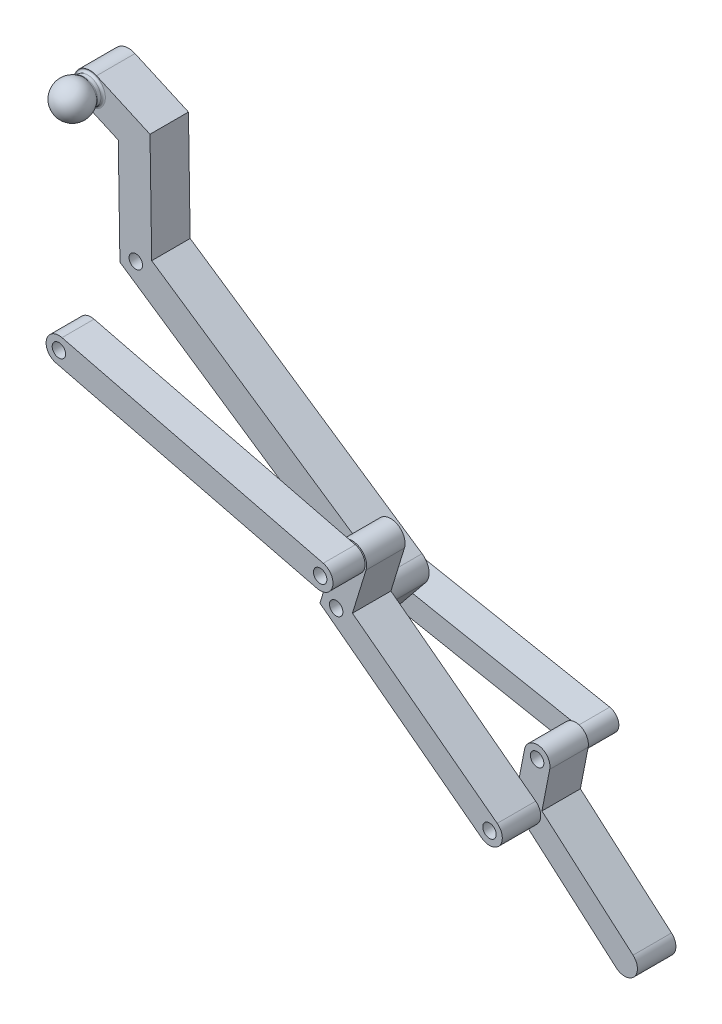
from build123d import *

# Parameters (mm, degrees)
BOSS_EXTRU_1_DEPTH           = 6
BOSS_EXTRU_2_DEPTH           = 6
BOSS_EXTRU_3_DEPTH           = 6
BOSS_EXTRU_4_START           = 6
BOSS_EXTRU_4_DEPTH           = 5
BOSS_EXTRU_5_START           = -6
BOSS_EXTRU_5_DEPTH           = 5
ENL_V_MAT_EXTRU_1_DEPTH      = 114.377471944
ENL_V_MAT_EXTRU_1_DEPTH_BACK = 114.377471944
ESQUISSE13_R                 = 1.05
ESQUISSE18_R                 = 2.05
BOSS_EXTRU_7_DEPTH           = 2
CONG_1_R                     = 0.35


with BuildPart() as part:
    # Esquisse6 → Boss.-Extru.1 (new body)
    with BuildSketch(Plane.XY):
        with BuildLine():
            Line((17.520833455, 1.659320664), (53.603544682, -22.767243471))
            Line((53.603544682, -22.767243471), (51.224988394, -25.694427738))
            ThreePointArc((51.224988394, -25.694427738), (51.588633301, -29.211210697), (55.10541626, -28.84756579))
            Line((55.10541626, -28.84756579), (59.204495728, -23.803009565))
            ThreePointArc((59.204495728, -23.803009565), (59.737439942, -21.861079373), (58.665750714, -20.156202661))
            Line((58.665750714, -20.156202661), (22.479166545, 4.340679336))
            Line((22.479166545, 4.340679336), (22.21173251, 21.297605282))
            Line((22.21173251, 21.297605282), (13.87148757, 25.027755547))
            ThreePointArc((13.87148757, 25.027755547), (10.568654312, 23.766291133), (11.830118726, 20.463457875))
            Line((11.830118726, 20.463457875), (17.262585357, 18.033802992))
            Line((17.262585357, 18.033802992), (17.520833455, 1.659320664))
        make_face()
    extrude(amount=-BOSS_EXTRU_1_DEPTH)


with BuildPart() as body_2:
    # Esquisse7 → Boss.-Extru.2 (new body)
    with BuildSketch(Plane.XY):
        with BuildLine():
            Line((54.728499187, -22.815417525), (57.616448353, -13.440743144))
            ThreePointArc((57.616448353, -13.440743144), (60.429142263, -11.952874545), (61.917010862, -14.765568456))
            Line((61.917010862, -14.765568456), (59.800064405, -21.637463553))
            Line((59.800064405, -21.637463553), (82.391906796, -38.737117746))
            ThreePointArc((82.391906796, -38.737117746), (82.779587834, -41.538849963), (79.977855618, -41.926531001))
            Line((79.977855618, -41.926531001), (54.728499187, -22.815417525))
        make_face()
    extrude(amount=BOSS_EXTRU_2_DEPTH)


with BuildPart() as body_3:
    # Esquisse8 → Boss.-Extru.3 (new body)
    with BuildSketch(Plane.XY):
        with BuildLine():
            Line((79.001000292, -41.082822034), (94.96112625, -54.967912393))
            ThreePointArc((94.96112625, -54.967912393), (97.78274183, -54.771735133), (97.58656457, -51.950119552))
            Line((97.58656457, -51.950119552), (83.368762121, -39.580826714))
            Line((83.368762121, -39.580826714), (84.581983157, -33.352591011))
            ThreePointArc((84.581983157, -33.352591011), (83.001280876, -31.007088869), (80.655778734, -32.58779115))
            Line((80.655778734, -32.58779115), (79.001000292, -41.082822034))
        make_face()
    extrude(amount=-BOSS_EXTRU_3_DEPTH)


with BuildPart() as body_4:
    # Esquisse9 → Boss.-Extru.4 (new body)
    with BuildSketch(Plane.XY.offset(BOSS_EXTRU_4_START)):
        with BuildLine():
            Line((19.481102657, -2.058727162), (60.247832265, -12.161882961))
            ThreePointArc((60.247832265, -12.161882961), (61.708002446, -14.584258457), (59.28562695, -16.044428638))
            Line((59.28562695, -16.044428638), (18.518897343, -5.941272838))
            ThreePointArc((18.518897343, -5.941272838), (17.058727162, -3.518897343), (19.481102657, -2.058727162))
        make_face()
    extrude(amount=BOSS_EXTRU_4_DEPTH)


with BuildPart() as body_5:
    # Esquisse10 → Boss.-Extru.5 (new body)
    with BuildSketch(Plane.XY.offset(BOSS_EXTRU_5_START)):
        with BuildLine():
            Line((53.497655329, -25.552865511), (82.951333947, -31.252059828))
            ThreePointArc((82.951333947, -31.252059828), (84.337012198, -33.302644082), (82.286427944, -34.688322333))
            Line((82.286427944, -34.688322333), (52.832749325, -28.989128017))
            ThreePointArc((52.832749325, -28.989128017), (51.447071074, -26.938543762), (53.497655329, -25.552865511))
        make_face()
    extrude(amount=-BOSS_EXTRU_5_DEPTH)


with BuildPart() as enl_v_mat_extru_1_tool:
    # Esquisse13 → Enlèv. mat.-Extru.1 (new, two sides: drawn at the far end of the back side and taken through both)
    with BuildSketch(Plane.XY.offset(-ENL_V_MAT_EXTRU_1_DEPTH_BACK)):
        with Locations(Location((20, 3, 0), (0, 0, 180))):
            Circle(ESQUISSE13_R)
        with Locations((19, -4)):
            Circle(ESQUISSE13_R)
        with Locations((59.766729607, -14.1031558)):
            Circle(ESQUISSE13_R)
        with Locations(Location((57.264281796, -22.226440539, 0), (0, 0, 180))):
            Circle(ESQUISSE13_R)
        with Locations((53.165202327, -27.270996764)):
            Circle(ESQUISSE13_R)
        with Locations((82.618880945, -32.97019108)):
            Circle(ESQUISSE13_R)
        with Locations((81.184881207, -40.331824374)):
            Circle(ESQUISSE13_R)
    extrude(amount=ENL_V_MAT_EXTRU_1_DEPTH + ENL_V_MAT_EXTRU_1_DEPTH_BACK)


with BuildPart() as part_1:
    add(part.part)

    # Enlèv. mat.-Extru.1: cut by enl_v_mat_extru_1_tool
    add(enl_v_mat_extru_1_tool.part, mode=Mode.SUBTRACT)

    # Esquisse18 → Boss.-Extru.7 (add)
    with BuildSketch(Plane(origin=(0, 0, 0), x_dir=(-1, 0, 0), z_dir=(0, 0, -1))):
        with Locations((-12.850803148, 22.745606711)):
            Circle(ESQUISSE18_R)
    extrude(amount=-BOSS_EXTRU_7_DEPTH)

    # Esquisse19 → Révolution1 (revolve)
    with BuildSketch(Plane(origin=(12.850803148, 0, 0), x_dir=(0, 0, -1), z_dir=(1, 0, 0))):
        with BuildLine():
            Line((-5.45, 22.745606711), (-0.05, 22.745606711))
            ThreePointArc((-0.05, 22.745606711), (-2.75, 25.445606711), (-5.45, 22.745606711))
        make_face()
    revolve(axis=Axis((12.850803148, 22.745606711, 0), (0, 0, 1)))

    # Congé1
    cong_1_edges = [part_1.edges().sort_by_distance(p)[0] for p in [
        (14.900803148, 22.745606711, 0),
        (14.30037205, 21.296037809, 0.992871661),
    ]]
    fillet(cong_1_edges, radius=CONG_1_R)


with BuildPart() as body_2_1:
    add(body_2.part)

    # Enlèv. mat.-Extru.1: cut by enl_v_mat_extru_1_tool
    add(enl_v_mat_extru_1_tool.part, mode=Mode.SUBTRACT)


with BuildPart() as body_3_1:
    add(body_3.part)

    # Enlèv. mat.-Extru.1: cut by enl_v_mat_extru_1_tool
    add(enl_v_mat_extru_1_tool.part, mode=Mode.SUBTRACT)


with BuildPart() as body_4_1:
    add(body_4.part)

    # Enlèv. mat.-Extru.1: cut by enl_v_mat_extru_1_tool
    add(enl_v_mat_extru_1_tool.part, mode=Mode.SUBTRACT)


with BuildPart() as body_5_1:
    add(body_5.part)

    # Enlèv. mat.-Extru.1: cut by enl_v_mat_extru_1_tool
    add(enl_v_mat_extru_1_tool.part, mode=Mode.SUBTRACT)


solid = Compound([part_1.part, body_2_1.part, body_3_1.part, body_4_1.part, body_5_1.part])
